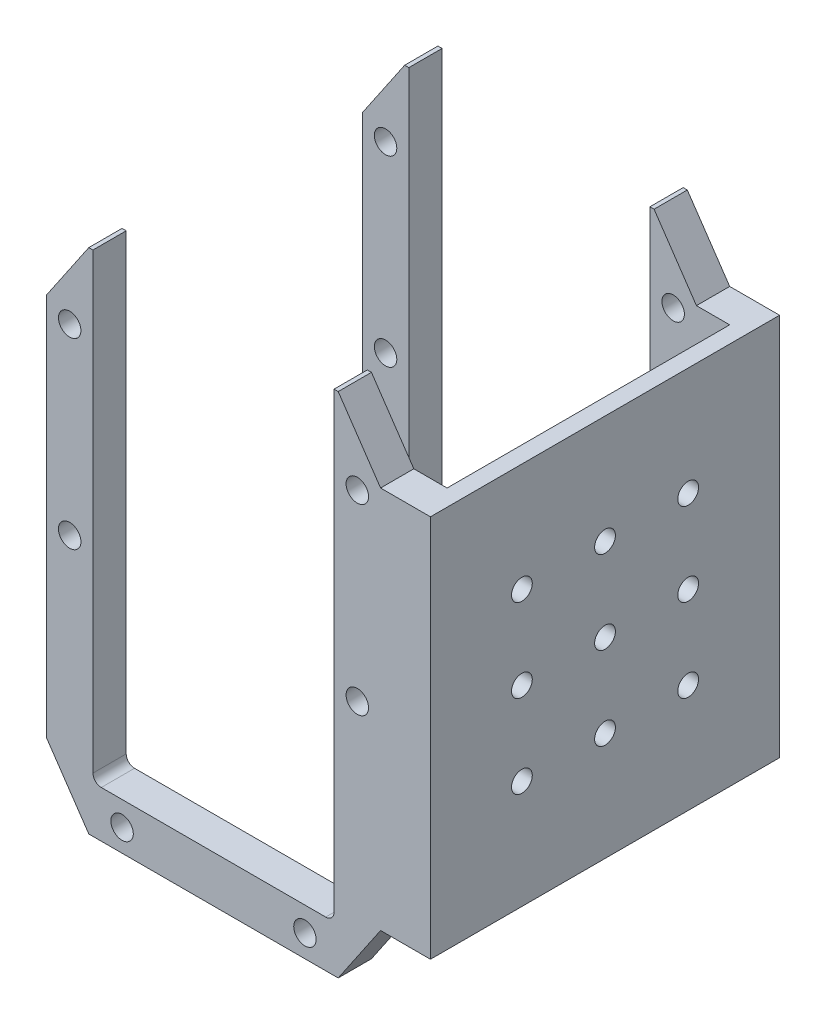
from build123d import *

# Parameters (mm, degrees)
EXTRUDE_2_DEPTH     = 42
SKETCH_2_R          = 1.35
CUT_EXTRUDE_1_DEPTH = 45
CUT_EXTRUDE_2_DEPTH = 45
SKETCH_4_W          = 4
SKETCH_4_H          = 46.1
EXTRUDE_3_DEPTH     = 4
SKETCH_5_W          = 2
SKETCH_5_H          = 46.1
EXTRUDE_4_DEPTH     = 42
SKETCH_6_R          = 1.25
CUT_EXTRUDE_3_DEPTH = 10


with BuildPart() as part:
    # 스케치1 → 보스-돌출2 (new body)
    with BuildSketch(Plane.XY):
        with BuildLine():
            Line((-14.5, -41.5), (-14.5, 11.5))
            Line((-14.5, 11.5), (-14.5, 13))
            Line((-14.5, 13), (-15, 13))
            Line((-15, 13), (-20.1, 5.5))
            Line((-20.1, 5.5), (-20.1, -40.6))
            Line((-20.1, -40.6), (-15, -48.1))
            Line((-15, -48.1), (15, -48.1))
            Line((15, -48.1), (20.1, -40.6))
            Line((20.1, -40.6), (20.1, 5.5))
            Line((20.1, 5.5), (15, 13))
            Line((15, 13), (14.5, 13))
            Line((14.5, 13), (14.5, 11.5))
            Line((14.5, 11.5), (14.5, -41.5))
            ThreePointArc((14.5, -41.5), (14.207106781, -42.207106781), (13.5, -42.5))
            Line((13.5, -42.5), (-13.5, -42.5))
            ThreePointArc((-13.5, -42.5), (-14.207106781, -42.207106781), (-14.5, -41.5))
        make_face()
    extrude(amount=EXTRUDE_2_DEPTH)

    # 스케치2 → 컷-돌출1 (cut)
    with BuildSketch(Plane(origin=(0, 0, 0), x_dir=(-1, 0, 0), z_dir=(0, 0, -1))):
        with Locations((-11, -45.405560676)):
            Circle(SKETCH_2_R)
        with Locations((11, -45.405560676)):
            Circle(SKETCH_2_R)
        with Locations((17.3, 3.87)):
            Circle(SKETCH_2_R)
        with Locations((17.3, -18.13)):
            Circle(SKETCH_2_R)
        with Locations((-17.3, 3.87)):
            Circle(SKETCH_2_R)
        with Locations((-17.3, -18.13)):
            Circle(SKETCH_2_R)
    extrude(amount=-CUT_EXTRUDE_1_DEPTH, mode=Mode.SUBTRACT)

    # 스케치3 → 컷-돌출2 (cut)
    with BuildSketch(Plane(origin=(20.1, 0, 0), x_dir=(0, 0, -1), z_dir=(1, 0, 0))):
        Polygon((-38, 5.5), (-38, -40.6), (-38, -48.1), (-4, -48.1), (-4, -40.6), (-4, 5.5), (-4, 13), (-38, 13), align=None)
    extrude(amount=-CUT_EXTRUDE_2_DEPTH, mode=Mode.SUBTRACT)


with BuildPart() as cut_extrude_2_piece_1:
    # of the separate pieces the step leaves, piece 1, a body of its own (cut_extrude_2_pieces)
    add(part.part.solids().sort_by_distance((-14.5, -41.5, 38))[0])



with BuildPart() as cut_extrude_2_piece_2:
    # of the separate pieces the step leaves, piece 2, a body of its own (cut_extrude_2_pieces)
    add(part.part.solids().sort_by_distance((-14.5, -41.5, 0))[0])


with BuildPart() as cut_extrude_2_piece_1_1:
    add(cut_extrude_2_piece_1.part)

    add(cut_extrude_2_piece_2.part)  # 보스-돌출3 merges 컷-돌출2 piece 2
    # 스케치4 → 보스-돌출3 (add)
    with BuildSketch(Plane(origin=(20.1, 0, 0), x_dir=(0, 0, -1), z_dir=(1, 0, 0))):
        with Locations((-40, -17.55)):
            Rectangle(SKETCH_4_W, SKETCH_4_H)
        with Locations((-2, -17.55)):
            Rectangle(SKETCH_4_W, SKETCH_4_H)
    extrude(amount=EXTRUDE_3_DEPTH)

    # 스케치5 → 보스-돌출4 (add)
    with BuildSketch(Plane.XY.offset(42)):
        with Locations((25.1, -17.55)):
            Rectangle(SKETCH_5_W, SKETCH_5_H)
    extrude(amount=-EXTRUDE_4_DEPTH)

    # 스케치6 → 컷-돌출3 (cut)
    with BuildSketch(Plane(origin=(26.1, 0, 0), x_dir=(0, 0, -1), z_dir=(1, 0, 0))):
        with Locations((-21, -17.55)):
            Circle(SKETCH_6_R)
        with Locations((-11, -17.55)):
            Circle(SKETCH_6_R)
        with Locations((-31, -17.55)):
            Circle(SKETCH_6_R)
        with Locations((-31, -7.55)):
            Circle(SKETCH_6_R)
        with Locations((-21, -7.55)):
            Circle(SKETCH_6_R)
        with Locations((-11, -7.55)):
            Circle(SKETCH_6_R)
        with Locations((-31, -27.55)):
            Circle(SKETCH_6_R)
        with Locations((-21, -27.55)):
            Circle(SKETCH_6_R)
        with Locations((-11, -27.55)):
            Circle(SKETCH_6_R)
    extrude(amount=-CUT_EXTRUDE_3_DEPTH, mode=Mode.SUBTRACT)


solid = cut_extrude_2_piece_1_1.part
